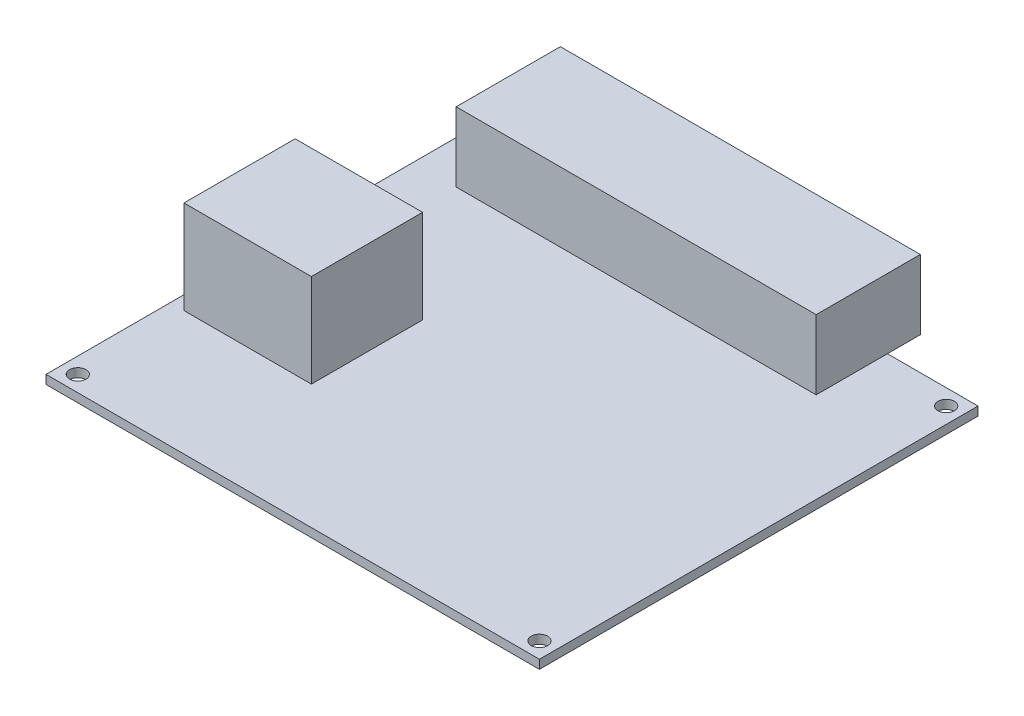
from build123d import *

# Parameters (mm, degrees)
SKETCH1_W           = 90
SKETCH1_H           = 80
SKETCH1_R           = 1.5
BOSS_EXTRUDE2_DEPTH = 1.6
SKETCH2_W           = 65.66
SKETCH2_H           = 19
BOSS_EXTRUDE3_DEPTH = 12.68
SKETCH3_W           = 23.240933929
SKETCH3_H           = 20.278854114
BOSS_EXTRUDE4_DEPTH = 17


with BuildPart() as part:
    # Sketch1 → Boss-Extrude2 (new body)
    with BuildSketch(Plane(origin=(0, 0, 0), x_dir=(1, 0, 0), z_dir=(0, 1, 0))):
        Rectangle(SKETCH1_W, SKETCH1_H)
        with Locations(Location((-42.1, 37.1, 0), (0, 0, 270))):
            Circle(SKETCH1_R, mode=Mode.SUBTRACT)
        with Locations(Location((42.1, 37.1, 0), (0, 0, 90))):
            Circle(SKETCH1_R, mode=Mode.SUBTRACT)
        with Locations(Location((-42.1, -37.1, 0), (0, 0, 90))):
            Circle(SKETCH1_R, mode=Mode.SUBTRACT)
        with Locations(Location((42.1, -37.1, 0), (0, 0, 270))):
            Circle(SKETCH1_R, mode=Mode.SUBTRACT)
    extrude(amount=BOSS_EXTRUDE2_DEPTH)

    # Sketch2 → Boss-Extrude3 (add)
    with BuildSketch(Plane(origin=(0, 1.6, 0), x_dir=(1, 0, 0), z_dir=(0, 1, 0))):
        with Locations((-4.35, 36.5)):
            Rectangle(SKETCH2_W, SKETCH2_H)
    extrude(amount=BOSS_EXTRUDE3_DEPTH)

    # Sketch3 → Boss-Extrude4 (add)
    with BuildSketch(Plane(origin=(0, 1.6, 0), x_dir=(1, 0, 0), z_dir=(0, 1, 0))):
        with Locations((-30.87398576, -7.2)):
            Rectangle(SKETCH3_W, SKETCH3_H)
    extrude(amount=BOSS_EXTRUDE4_DEPTH)


solid = part.part
